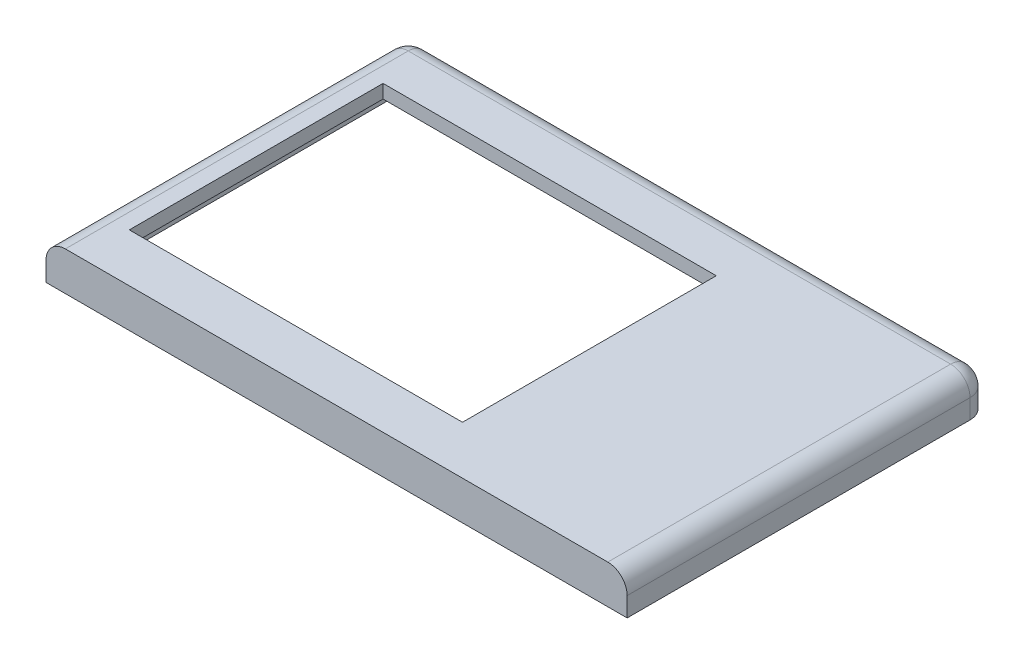
from build123d import *

# Parameters (mm, degrees)
SKETCH1_W           = 300
SKETCH1_H           = 187
BOSS_EXTRUDE1_DEPTH = 20
FILLET1_R           = 10
FILLET2_R           = 10
SHELL2_T            = -7
SKETCH2_W           = 172
SKETCH2_H           = 131
CUT_EXTRUDE2_DEPTH  = 7
FILLET3_R           = 10


with BuildPart() as part:
    # Sketch1 → Boss-Extrude1 (new body)
    with BuildSketch(Plane(origin=(0, 0, 0), x_dir=(1, 0, 0), z_dir=(0, 1, 0))):
        with Locations((71.737321437, -61.518699121)):
            Rectangle(SKETCH1_W, SKETCH1_H)
    extrude(amount=BOSS_EXTRUDE1_DEPTH)

    # Fillet1
    fillet1_edges = [part.edges().sort_by_distance(p)[0] for p in [
        (-78.262678563, 20, 61.518699121),
    ]]
    fillet(fillet1_edges, radius=FILLET1_R)

    # Fillet2
    fillet2_edges = [part.edges().sort_by_distance(p)[0] for p in [
        (221.737321437, 20, 61.518699121),
    ]]
    fillet(fillet2_edges, radius=FILLET2_R)

    # Shell2
    shell2_openings = [part.faces().sort_by_distance(p)[0] for p in [
        (71.737321437, 0, 61.518699121),
    ]]
    offset(amount=SHELL2_T, openings=shell2_openings, kind=Kind.INTERSECTION)

    # Sketch2 → Cut-Extrude2 (cut)
    with BuildSketch(Plane(origin=(0, 20, 0), x_dir=(1, 0, 0), z_dir=(0, 1, 0))):
        with Locations((25.737321437, -64.518699121)):
            Rectangle(SKETCH2_W, SKETCH2_H)
    extrude(amount=-CUT_EXTRUDE2_DEPTH, mode=Mode.SUBTRACT)

    # Fillet3
    fillet3_edges = [part.edges().sort_by_distance(p)[0] for p in [
        (71.737321437, 20, -31.981300879),
        (-78.262678563, 5, -31.981300879),
        (-75.333746375, 17.071067812, -31.981300879),
        (221.737321437, 5, -31.981300879),
        (218.808389249, 17.071067812, -31.981300879),
    ]]
    fillet(fillet3_edges, radius=FILLET3_R)


solid = part.part
